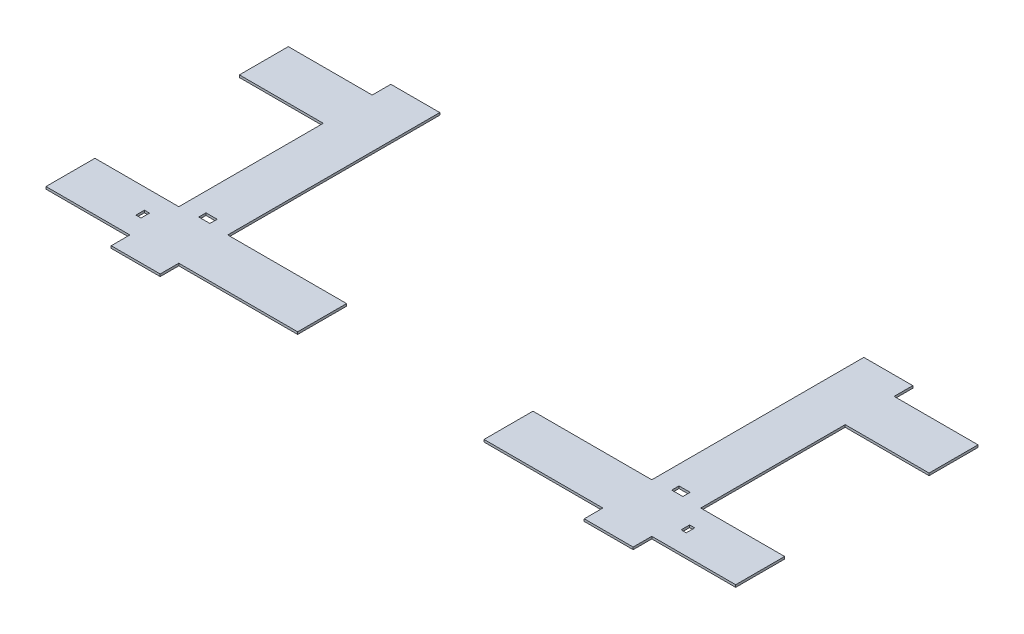
from build123d import *

# Parameters (mm, degrees)
SKETCH_1_W        = 2.20243199
SKETCH_1_H        = 3.65801407
SKETCH_1_W_2      = 4.7856148
SKETCH_1_H_2      = 3.120912274
EXTRUDE_1_DEPTH   = 1
EXTRUDE_1_2_DEPTH = 1


with BuildPart() as part:
    # 草图1 → 凸台-拉伸1 (new body)
    with BuildSketch(Plane(origin=(0, 0, 0), x_dir=(1, 0, 0), z_dir=(0, 1, 0))):
        Polygon((0, 0), (0, -8), (-21, -8), (-21, 0), (-57, 0), (-57, 21), (-21, 21), (-21, 83), (-57, 83), (-57, 104), (-21, 104), (-21, 112), (0, 112), (0, 21), (51, 21), (51, 0), align=None)
        with Locations((-26, 10.5)):
            Rectangle(SKETCH_1_W, SKETCH_1_H, mode=Mode.SUBTRACT)
        with Locations((-10.5, 23)):
            Rectangle(SKETCH_1_W_2, SKETCH_1_H_2, mode=Mode.SUBTRACT)
    extrude(amount=EXTRUDE_1_DEPTH)


with BuildPart() as body_2:
    # 草图1 → Extrude 1 2 (new body)
    with BuildSketch(Plane(origin=(0, 0, 0), x_dir=(1, 0, 0), z_dir=(0, 1, 0))):
        Polygon((203, 104), (203, 112), (182, 112), (182, 21), (131, 21), (131, 0), (182, 0), (182, -8), (203, -8), (203, 0), (239, 0), (239, 21), (203, 21), (203, 83), (239, 83), (239, 104), align=None)
        with Locations((192.5, 23)):
            Rectangle(SKETCH_1_W_2, SKETCH_1_H_2, mode=Mode.SUBTRACT)
        with Locations((208, 10.5)):
            Rectangle(SKETCH_1_W, SKETCH_1_H, mode=Mode.SUBTRACT)
    extrude(amount=EXTRUDE_1_2_DEPTH)


solid = Compound([part.part, body_2.part])
